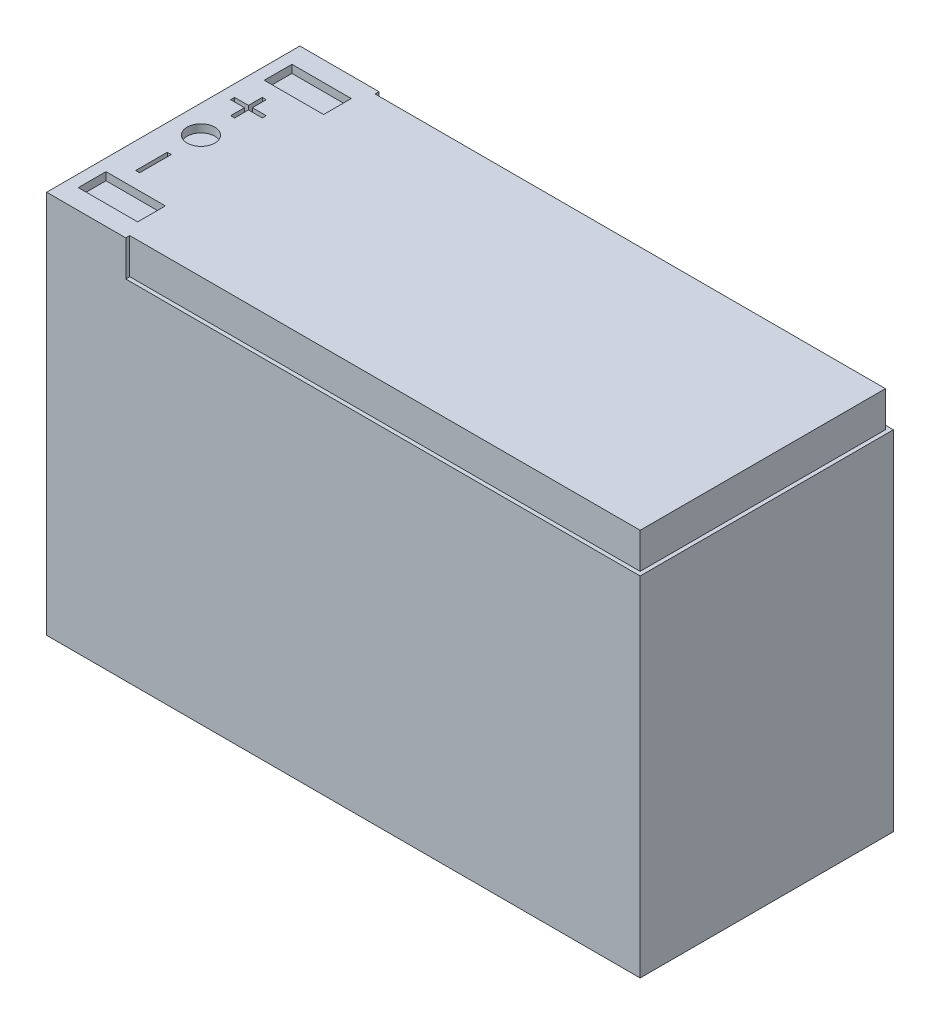
from build123d import *

# Parameters (mm, degrees)
SKETCH1_W               = 150
SKETCH1_H               = 97
BOSS_EXTRUDE2_DEPTH     = 64
CUT_EXTRUDE1_DEPTH      = 190.74983531
CUT_EXTRUDE1_DEPTH_BACK = 9
SKETCH4_R               = 3.5
SKETCH4_W               = 15
SKETCH4_H               = 7
SKETCH4_W_2             = 1
SKETCH4_H_2             = 8
CUT_EXTRUDE2_DEPTH      = 2


with BuildPart() as part:
    # Sketch1 → Boss-Extrude2 (new body)
    with BuildSketch(Plane.XY):
        with Locations((75, -48.5)):
            Rectangle(SKETCH1_W, SKETCH1_H)
    extrude(amount=BOSS_EXTRUDE2_DEPTH)

    # Sketch3 → Cut-Extrude1 (cut, two sides: drawn at the far end of the back side and taken through both)
    with BuildSketch(Plane(origin=(0, 0, 0), x_dir=(1, 0, 0), z_dir=(0, 1, 0)).offset(-CUT_EXTRUDE1_DEPTH_BACK)):
        Polygon((20, 299.799930987), (20, 0), (20, -1), (149, -1), (149, -63), (20, -63), (20, -64), (20, -363.799930987), (619.599861974, -363.799930987), (619.599861974, 299.799930987), align=None)
    extrude(amount=CUT_EXTRUDE1_DEPTH + CUT_EXTRUDE1_DEPTH_BACK, mode=Mode.SUBTRACT)

    # Sketch4 → Cut-Extrude2 (cut)
    with BuildSketch(Plane(origin=(0, 0, 0), x_dir=(1, 0, 0), z_dir=(0, 1, 0))):
        with Locations(Location((7, -32, 0), (0, 0, 270))):
            Circle(SKETCH4_R)
        with Locations((10.5, -8.5)):
            Rectangle(SKETCH4_W, SKETCH4_H)
        with Locations((10.5, -55.5)):
            Rectangle(SKETCH4_W, SKETCH4_H)
        Polygon((6.5, -16), (6.5, -19.5), (3, -19.5), (3, -20.5), (6.5, -20.5), (6.5, -24), (7.5, -24), (7.5, -20.5), (11, -20.5), (11, -19.5), (7.5, -19.5), (7.5, -16), align=None)
        with Locations((7, -44)):
            Rectangle(SKETCH4_W_2, SKETCH4_H_2)
    extrude(amount=-CUT_EXTRUDE2_DEPTH, mode=Mode.SUBTRACT)


solid = part.part
